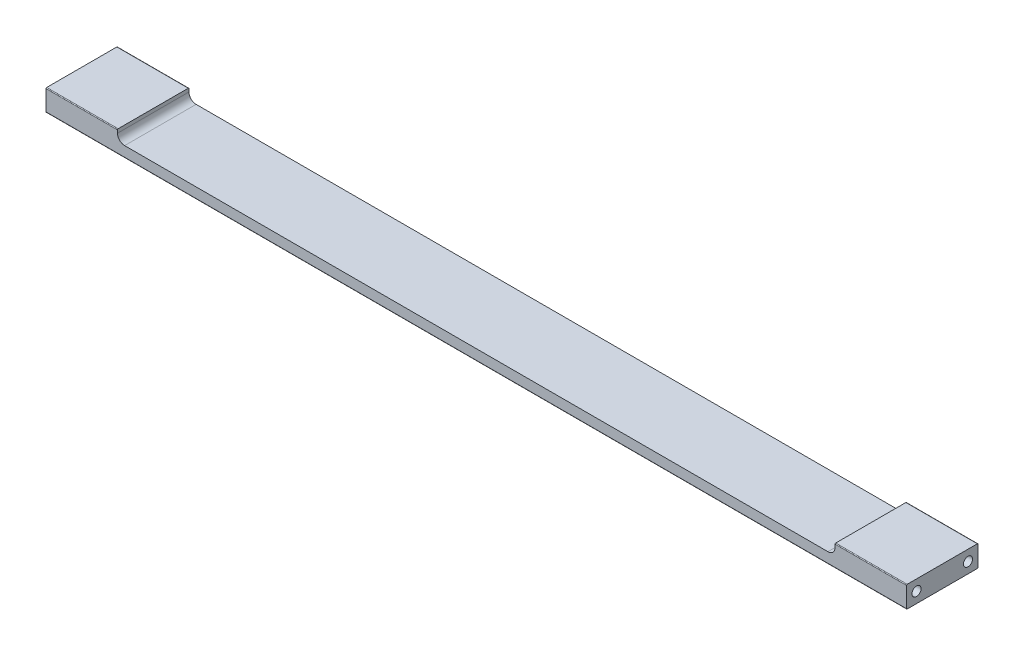
from build123d import *

# Parameters (mm, degrees)
BOSS_EXTRUDE1_DEPTH            = 4.7625
BOSS_EXTRUDE1_DEPTH_BACK       = 4.7625
SKETCH3_W                      = 382.27
SKETCH3_H                      = 31.75
FILLET1_R                      = 0.314325
TAP_DRILL_FOR_10_32_TAP1_D     = 4.0386
TAP_DRILL_FOR_10_32_TAP1_DEPTH = 25.4
TAP_DRILL_FOR_10_32_TAP1_TIP   = 1.213317848
TAP_DRILL_FOR_10_32_TAP2_D     = 4.0386
TAP_DRILL_FOR_10_32_TAP2_DEPTH = 25.4
TAP_DRILL_FOR_10_32_TAP2_TIP   = 1.213317848
CUT_EXTRUDE1_DEPTH             = 194.812621187


with BuildPart() as part:
    # Sketch3 → Boss-Extrude1 (new, two sides: drawn at the far end of the back side and taken through both)
    with BuildSketch(Plane(origin=(0, 0, 0), x_dir=(1, 0, 0), z_dir=(0, 1, 0)).offset(-BOSS_EXTRUDE1_DEPTH_BACK)):
        Rectangle(SKETCH3_W, SKETCH3_H)
    extrude(amount=BOSS_EXTRUDE1_DEPTH + BOSS_EXTRUDE1_DEPTH_BACK)

    # Fillet1
    fillet1_edges = [part.edges().sort_by_distance(p)[0] for p in [
        (0, 4.7625, 15.875),
        (0, -4.7625, -15.875),
        (0, 4.7625, -15.875),
        (0, -4.7625, 15.875),
    ]]
    fillet(fillet1_edges, radius=FILLET1_R)

    # Tap Drill for #10-32 Tap1
    with Locations(Plane.ZY.offset(191.135)):
        with Locations((-11.43, 0), (11.43, 0)):
            Hole(TAP_DRILL_FOR_10_32_TAP1_D / 2, depth=TAP_DRILL_FOR_10_32_TAP1_DEPTH)
            with Locations((0, 0, -(TAP_DRILL_FOR_10_32_TAP1_DEPTH + TAP_DRILL_FOR_10_32_TAP1_TIP / 2))):  # 118° drill point
                Cone(0, TAP_DRILL_FOR_10_32_TAP1_D / 2, TAP_DRILL_FOR_10_32_TAP1_TIP, mode=Mode.SUBTRACT)

    # Tap Drill for #10-32 Tap2
    with Locations(Plane(origin=(191.135, 0, 0), x_dir=(0, 0, -1), z_dir=(1, 0, 0))):
        with Locations((-11.43, 0), (11.43, 0)):
            Hole(TAP_DRILL_FOR_10_32_TAP2_D / 2, depth=TAP_DRILL_FOR_10_32_TAP2_DEPTH)
            with Locations((0, 0, -(TAP_DRILL_FOR_10_32_TAP2_DEPTH + TAP_DRILL_FOR_10_32_TAP2_TIP / 2))):  # 118° drill point
                Cone(0, TAP_DRILL_FOR_10_32_TAP2_D / 2, TAP_DRILL_FOR_10_32_TAP2_TIP, mode=Mode.SUBTRACT)

    # Sketch9 → Cut-Extrude1 (cut, through all)
    with BuildSketch(Plane(origin=(0, 0, -15.875), x_dir=(-1, 0, 0), z_dir=(0, 0, -1))):
        with BuildLine():
            Line((159.385, 4.7625), (159.385, 3.175))
            ThreePointArc((159.385, 3.175), (158.45506403, 0.92993597), (156.21, 0))
            Line((156.21, 0), (-156.21, 0))
            ThreePointArc((-156.21, 0), (-158.45506403, 0.92993597), (-159.385, 3.175))
            Line((-159.385, 3.175), (-159.385, 4.7625))
            Line((-159.385, 4.7625), (159.385, 4.7625))
        make_face()
    extrude(amount=-CUT_EXTRUDE1_DEPTH, mode=Mode.SUBTRACT)


solid = part.part
